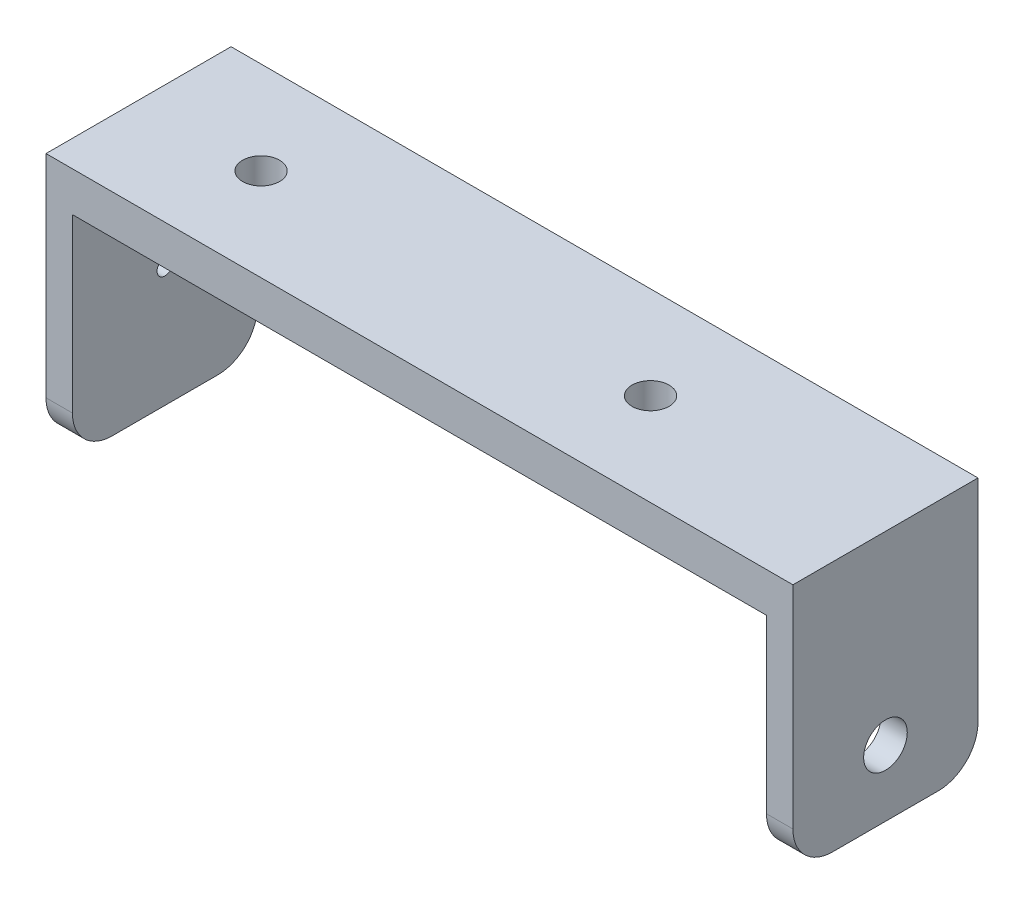
from build123d import *

# Parameters (mm, degrees)
EXTRUDE_1_DEPTH     = 14
SKETCH_2_R          = 1.65
CUT_EXTRUDE_1_DEPTH = 2
SKETCH_3_R          = 1.4
CUT_EXTRUDE_2_DEPTH = 14
FILLET_1_R          = 3
SKETCH_5_R          = 0.6
CUT_EXTRUDE_3_DEPTH = 10


with BuildPart() as part:
    # 草图1 → 凸台-拉伸1 (new body)
    with BuildSketch(Plane.XY):
        Polygon((-28.25, 19), (-28.25, 0), (-26.25, 0), (-26.25, 16), (0, 16), (0, 19), align=None)
        Polygon((28.25, 19), (0, 19), (0, 16), (26.25, 16), (26.25, 0), (28.25, 0), align=None)
    extrude(amount=EXTRUDE_1_DEPTH)

    # 草图2 → 切除-拉伸1 (cut)
    with BuildSketch(Plane(origin=(28.25, 0, 0), x_dir=(0, 0, -1), z_dir=(1, 0, 0))):
        with Locations((-7, 5)):
            Circle(SKETCH_2_R)
    extrude(amount=-CUT_EXTRUDE_1_DEPTH, mode=Mode.SUBTRACT)

    # 草图3 → 切除-拉伸2 (cut)
    with BuildSketch(Plane(origin=(0, 19, 0), x_dir=(1, 0, 0), z_dir=(0, 1, 0))):
        with Locations(Location((-18.98, -7, 0), (0, 0, 270))):
            Circle(SKETCH_3_R)
        with Locations(Location((10.48, -7, 0), (0, 0, 270))):
            Circle(SKETCH_3_R)
    extrude(amount=-CUT_EXTRUDE_2_DEPTH, mode=Mode.SUBTRACT)

    # 圆角1
    fillet_1_edges = [part.edges().sort_by_distance(p)[0] for p in [
        (-27.25, 0, 0),
        (27.25, 0, 0),
        (27.25, 0, 14),
        (-27.25, 0, 14),
    ]]
    fillet(fillet_1_edges, radius=FILLET_1_R)

    # 草图5 → 切除-拉伸3 (cut)
    with BuildSketch(Plane.ZY.offset(28.25)):
        with Locations((7, 9.085)):
            Circle(SKETCH_5_R)
        with Locations((7, 13.085)):
            Circle(SKETCH_5_R)
    extrude(amount=-CUT_EXTRUDE_3_DEPTH, mode=Mode.SUBTRACT)


solid = part.part
